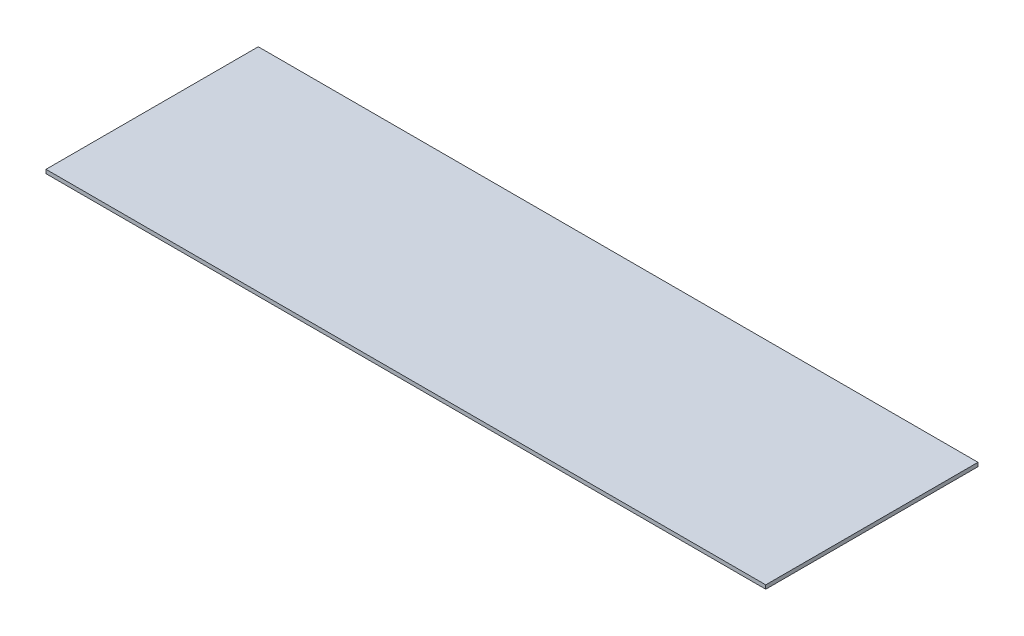
from build123d import *

# Parameters (mm, degrees)
SKETCH1_W           = 1881.943063781
SKETCH1_H           = 555.020391766
BOSS_EXTRUDE1_DEPTH = 10


with BuildPart() as part:
    # Sketch1 → Boss-Extrude1 (new body)
    with BuildSketch(Plane(origin=(0, 0, 0), x_dir=(1, 0, 0), z_dir=(0, 1, 0))):
        with Locations((851.979680279, -260.206224736)):
            Rectangle(SKETCH1_W, SKETCH1_H)
    extrude(amount=-BOSS_EXTRUDE1_DEPTH)


solid = part.part
